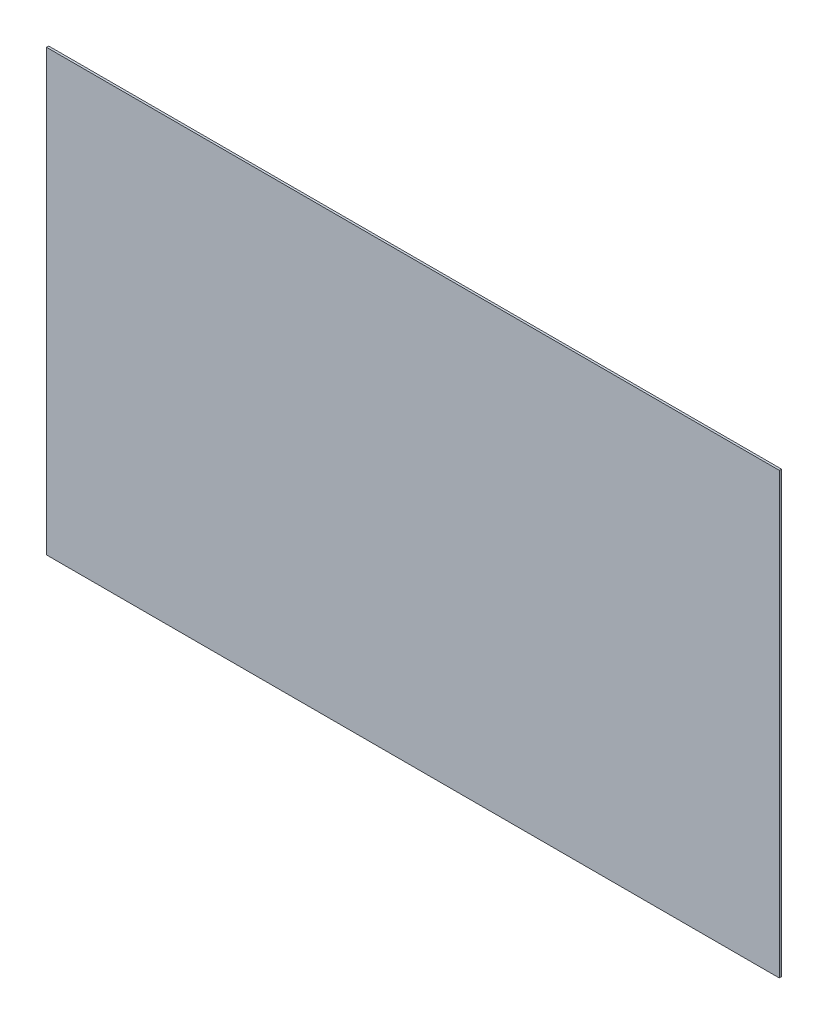
from build123d import *

# Parameters (mm, degrees)
SKETCH_1_W      = 1000
SKETCH_1_H      = 600
EXTRUDE_1_DEPTH = 3


with BuildPart() as part:
    # 草图1 → 凸台-拉伸1 (new body)
    with BuildSketch(Plane.XY):
        with Locations((500, 300)):
            Rectangle(SKETCH_1_W, SKETCH_1_H)
    extrude(amount=EXTRUDE_1_DEPTH)


solid = part.part
